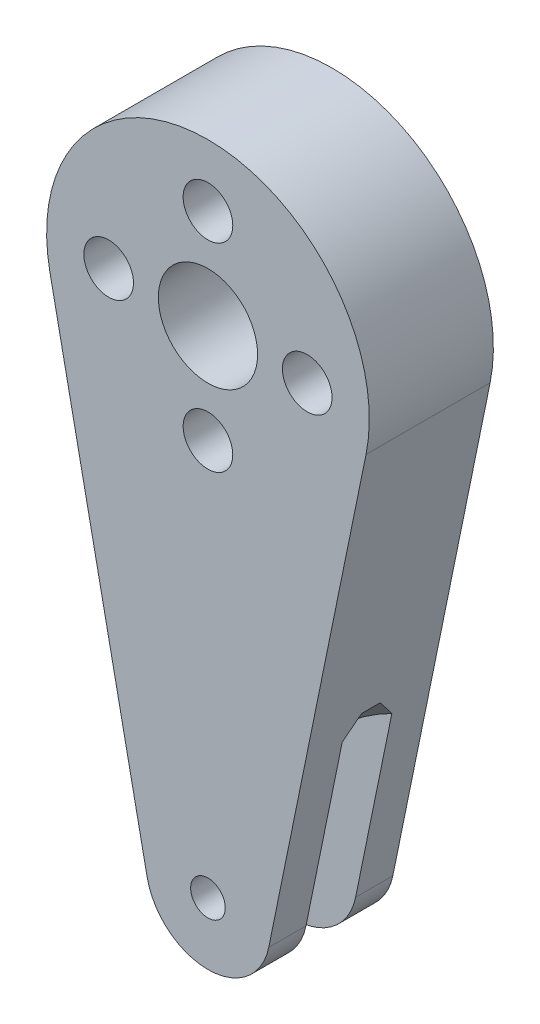
from build123d import *

# Parameters (mm, degrees)
SKETCH1_R                       = 4
SKETCH1_R_2                     = 2
SKETCH1_R_3                     = 1.395
BOSS_EXTRUDE1_DEPTH             = 5
SKETCH2_R                       = 5
BOSS_EXTRUDE2_DEPTH             = 2
BOSS_EXTRUDE3_REACH             = 49.032
SKETCH3_R                       = 19
BOSS_EXTRUDE3_DIRECTION_2_REACH = 49.032
CHAMFER1_SIZE                   = 1.25


with BuildPart() as part:
    # Sketch1 → Boss-Extrude1 (new, symmetric)
    with BuildSketch(Plane.XY):
        with BuildLine():
            Line((4.898582231, -40.924328172), (12.736313801, -2.605054848))
            ThreePointArc((12.736313801, -2.605054848), (0, 13), (-12.736313801, -2.605054848))
            Line((-12.736313801, -2.605054848), (-4.898582231, -40.924328172))
            ThreePointArc((-4.898582231, -40.924328172), (0, -44.922384), (4.898582231, -40.924328172))
        make_face()
        Circle(SKETCH1_R, mode=Mode.SUBTRACT)
        with Locations((0, 8)):
            Circle(SKETCH1_R_2, mode=Mode.SUBTRACT)
        with Locations((8, 0)):
            Circle(SKETCH1_R_2, mode=Mode.SUBTRACT)
        with Locations((0, -8)):
            Circle(SKETCH1_R_2, mode=Mode.SUBTRACT)
        with Locations((-8, 0)):
            Circle(SKETCH1_R_2, mode=Mode.SUBTRACT)
        with Locations((0, -39.922384)):
            Circle(SKETCH1_R_3, mode=Mode.SUBTRACT)
    extrude(amount=BOSS_EXTRUDE1_DEPTH, both=True)


with BuildPart() as body_2:
    # Sketch2 → Boss-Extrude2 (new, symmetric)
    with BuildSketch(Plane.XY):
        with Locations((0, -39.922384)):
            Circle(SKETCH2_R)
    extrude(amount=BOSS_EXTRUDE2_DEPTH, both=True)


with BuildPart() as part_1:
    add(part.part)

    # Combine1: cut body 2
    add(body_2.part, mode=Mode.SUBTRACT)


with BuildPart() as body_2_2:

    # Boss-Extrude3: up to this face of the body (flat: up to its plane)
    boss_extrude3_end = Plane(part_1.part.faces().sort_by_distance((0, -35.063805356, 2))[0])
    # Sketch3 → Boss-Extrude3 (new, up to the picked face)
    with BuildSketch(Plane.XY, mode=Mode.PRIVATE) as boss_extrude3_sk1:
        with Locations((15.804791675, -42.49169824)):
            Circle(SKETCH3_R)
    boss_extrude3_tool1 = split(extrude(boss_extrude3_sk1.sketch, amount=BOSS_EXTRUDE3_REACH, mode=Mode.PRIVATE), bisect_by=boss_extrude3_end, keep=Keep.BOTH, mode=Mode.PRIVATE)
    add(boss_extrude3_tool1.solids().sort_by(Axis((15.804792, -42.491698, 0), (0, 0, 1)))[0])


    # Boss-Extrude3 direction 2: up to this face of the body (flat: up to its plane)
    boss_extrude3_direction_2_end = Plane(part_1.part.faces().sort_by_distance((0, -35.063805356, -2))[0])
    # Sketch3 → Boss-Extrude3 direction 2 (add, up to the picked face)
    with BuildSketch(Plane.XY, mode=Mode.PRIVATE) as boss_extrude3_direction_2_sk1:
        with Locations((15.804791675, -42.49169824)):
            Circle(SKETCH3_R)
    boss_extrude3_direction_2_tool1 = split(extrude(boss_extrude3_direction_2_sk1.sketch, amount=-BOSS_EXTRUDE3_DIRECTION_2_REACH, mode=Mode.PRIVATE), bisect_by=boss_extrude3_direction_2_end, keep=Keep.BOTH, mode=Mode.PRIVATE)
    add(boss_extrude3_direction_2_tool1.solids().sort_by(Axis((15.804792, -42.491698, 0), (0, 0, -1)))[0])

    # Chamfer1
    chamfer1_edges = [body_2_2.edges().sort_by_distance(p)[0] for p in [
        (-3.195208325, -42.49169824, -2),
        (-3.195208325, -42.49169824, 2),
    ]]
    chamfer(chamfer1_edges, length=CHAMFER1_SIZE)


with BuildPart() as part_2:
    add(part_1.part)

    # Combine2: cut body 2 2
    add(body_2_2.part, mode=Mode.SUBTRACT)


solid = part_2.part
